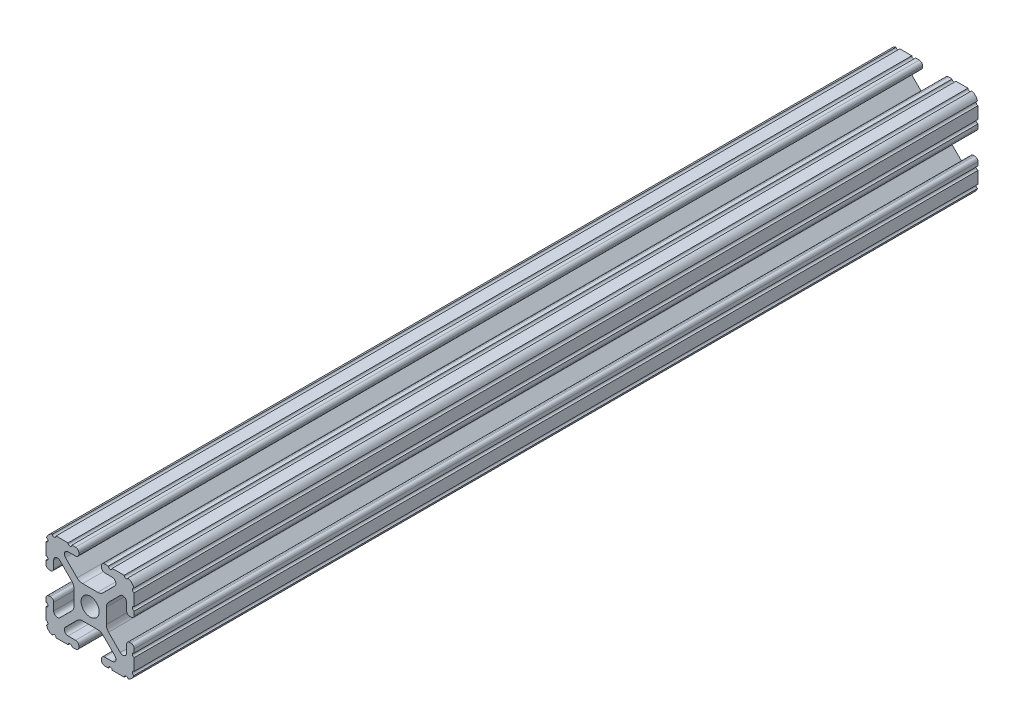
from build123d import *

# Parameters (mm, degrees)
BOSS_EXTRUDE1_START     = -121.434777
BOSS_EXTRUDE1_DEPTH     = 242.869554
CUT_EXTRUDE1_DEPTH      = 123.755794426
CUT_EXTRUDE1_DEPTH_BACK = 123.755794426
SKETCH5_R               = 0.55245


with BuildPart() as part:
    # Sketch4 → Boss-Extrude1 (new body)
    with BuildSketch(Plane.XY.offset(BOSS_EXTRUDE1_START)):
        with BuildLine():
            Line((4.190365, -12.7), (10.11729625, -12.7))
            ThreePointArc((10.11729625, -12.7), (11.943543585, -11.943543585), (12.7, -10.11729625))
            Line((12.7, -10.11729625), (12.7, -4.190365))
            ThreePointArc((12.7, -4.190365), (12.42492494, -3.52627506), (11.760835, -3.2512))
            Line((11.760835, -3.2512), (11.429365, -3.2512))
            ThreePointArc((11.429365, -3.2512), (10.76527506, -3.52627506), (10.4902, -4.190365))
            Line((10.4902, -4.190365), (10.4902, -6.348478019))
            ThreePointArc((10.4902, -6.348478019), (9.830707141, -7.335478831), (8.666460301, -7.103895736))
            Line((8.666460301, -7.103895736), (5.299899128, -3.737334563))
            ThreePointArc((5.299899128, -3.737334563), (4.817571085, -3.015479634), (4.6482, -2.16399369))
            Line((4.6482, -2.16399369), (4.6482, 0))
            Line((4.6482, 0), (2.6035, 0))
            ThreePointArc((2.6035, 0), (1.840952505, -1.840952505), (0, -2.6035))
            Line((0, -2.6035), (0, -4.6482))
            Line((0, -4.6482), (2.16399369, -4.6482))
            ThreePointArc((2.16399369, -4.6482), (3.015479634, -4.817571085), (3.737334563, -5.299899128))
            Line((3.737334563, -5.299899128), (7.103895736, -8.666460301))
            ThreePointArc((7.103895736, -8.666460301), (7.335478831, -9.830707141), (6.348478019, -10.4902))
            Line((6.348478019, -10.4902), (4.190365, -10.4902))
            ThreePointArc((4.190365, -10.4902), (3.52627506, -10.76527506), (3.2512, -11.429365))
            Line((3.2512, -11.429365), (3.2512, -11.760835))
            ThreePointArc((3.2512, -11.760835), (3.52627506, -12.42492494), (4.190365, -12.7))
        make_face()
    extrude(amount=BOSS_EXTRUDE1_DEPTH)

    # Sketch5 → Cut-Extrude1 (cut, two sides: drawn at the far end of the back side and taken through both)
    with BuildSketch(Plane.XY.offset(-CUT_EXTRUDE1_DEPTH_BACK)):
        with Locations((10.356153152, -12.7)):
            Circle(SKETCH5_R)
        with Locations((5.796028019, -12.7)):
            Circle(SKETCH5_R)
        with Locations((12.7, -10.356153152)):
            Circle(SKETCH5_R)
        with Locations((12.7, -5.796028019)):
            Circle(SKETCH5_R)
    extrude(amount=CUT_EXTRUDE1_DEPTH + CUT_EXTRUDE1_DEPTH_BACK, mode=Mode.SUBTRACT)

    # Mirror1: part across plane


with BuildPart() as part_1:
    add(part.part)
    add(part.part.mirror(Plane(origin=(0, 0, 0), x_dir=(0, 0, 1), z_dir=(1, 0, 0))))

    # Mirror2: part across plane


with BuildPart() as part_2:
    add(part_1.part)
    add(part_1.part.mirror(Plane.ZX))


solid = part_2.part
